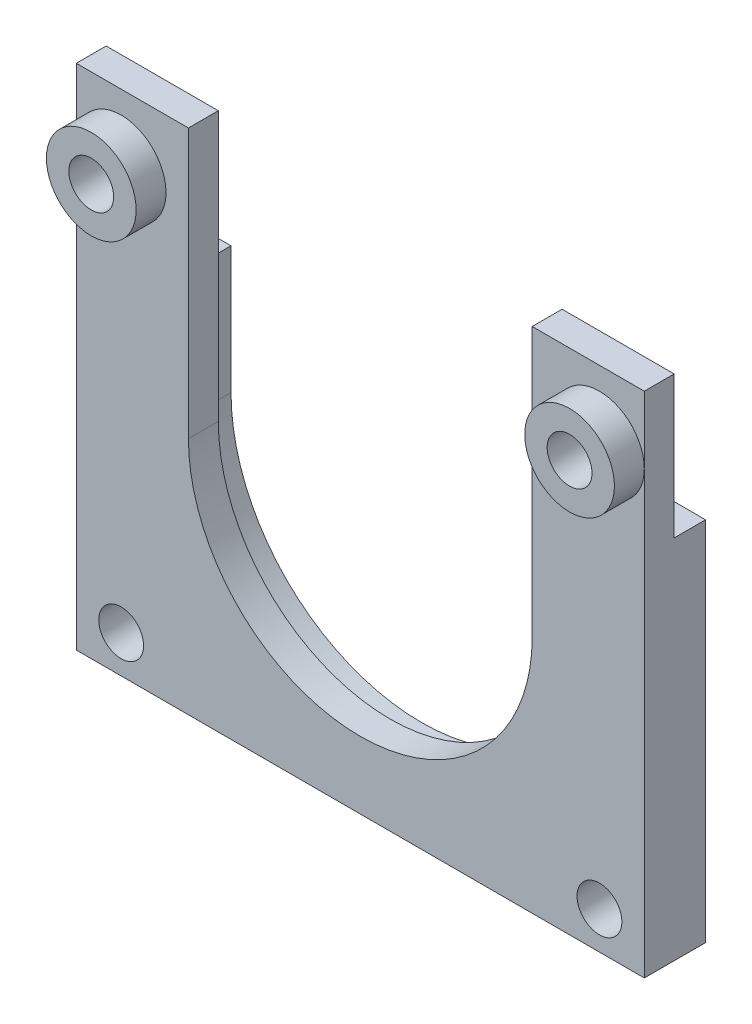
from build123d import *

# Parameters (mm, degrees)
SKETCH_1_R          = 1.5
EXTRUDE_1_DEPTH     = 4.1
EXTRUDE_START       = -2
EXTRUDE_2_DEPTH     = 2
SKETCH_3_W          = 78.409677764
SKETCH_3_H          = 10
CUT_EXTRUDE_1_DEPTH = 2.1
SKETCH_4_W          = 7.5
SKETCH_4_H          = 2
EXTRUDE_3_DEPTH     = 2
SKETCH_5_R          = 3
SKETCH_5_R_2        = 1.5
EXTRUDE_4_DEPTH     = 2


with BuildPart() as part:
    # 草图1 → 凸台-拉伸1 (new body)
    with BuildSketch(Plane.XY):
        with BuildLine():
            Line((-12.75, 0), (-12.75, 16))
            Line((-12.75, 16), (-19, 16))
            Line((-19, 16), (-19, -16))
            Line((-19, -16), (19, -16))
            Line((19, -16), (19, 16))
            Line((19, 16), (12.75, 16))
            Line((12.75, 16), (12.75, 0))
            ThreePointArc((12.75, 0), (0, -12.75), (-12.75, 0))
        make_face()
        with Locations((-16, 13.5)):
            Circle(SKETCH_1_R, mode=Mode.SUBTRACT)
        with Locations((16, 13.5)):
            Circle(SKETCH_1_R, mode=Mode.SUBTRACT)
        with Locations(Location((16, -13.5, 0), (0, 0, 180))):
            Circle(SKETCH_1_R, mode=Mode.SUBTRACT)
        with Locations(Location((-16, -13.5, 0), (0, 0, 180))):
            Circle(SKETCH_1_R, mode=Mode.SUBTRACT)
    extrude(amount=EXTRUDE_1_DEPTH)

    # 草图2 → 凸台-拉伸2 (add)
    with BuildSketch(Plane.XY.offset(4.1).offset(EXTRUDE_START)):
        with BuildLine():
            Line((-12.75, 0), (-12.75, 16))
            Line((-12.75, 16), (-11.5, 16))
            Line((-11.5, 16), (-11.5, 0))
            ThreePointArc((-11.5, 0), (0, -11.5), (11.5, 0))
            Line((11.5, 0), (11.5, 16))
            Line((11.5, 16), (12.75, 16))
            Line((12.75, 16), (12.75, 0))
            ThreePointArc((12.75, 0), (0, -12.75), (-12.75, 0))
        make_face()
    extrude(amount=EXTRUDE_2_DEPTH)

    # 草图3 → 切除-拉伸1 (cut)
    with BuildSketch(Plane(origin=(0, 0, 0), x_dir=(-1, 0, 0), z_dir=(0, 0, -1))):
        with Locations((16, 13.5)):
            Rectangle(SKETCH_3_W, SKETCH_3_H)
    extrude(amount=-CUT_EXTRUDE_1_DEPTH, mode=Mode.SUBTRACT)

    # 草图4 → 凸台-拉伸3 (add)
    with BuildSketch(Plane.XY.offset(4.1)):
        with Locations((-15.25, 17)):
            Rectangle(SKETCH_4_W, SKETCH_4_H)
        with Locations((15.25, 17)):
            Rectangle(SKETCH_4_W, SKETCH_4_H)
    extrude(amount=-EXTRUDE_3_DEPTH)

    # 草图5 → 凸台-拉伸4 (add)
    # profile 1 of 2: a face of its own
    with BuildSketch(Plane.XY.offset(4.1)):
        with Locations(Location((-16, 13.5, 0), (0, 0, 180))):
            Circle(SKETCH_5_R)
        with Locations((-16, 13.5)):
            Circle(SKETCH_5_R_2, mode=Mode.SUBTRACT)
    # profile 2 of 2: a face of its own
    with BuildSketch(Plane.XY.offset(4.1)):
        with Locations((16, 13.5)):
            Circle(SKETCH_5_R)
        with Locations((16, 13.5)):
            Circle(SKETCH_5_R_2, mode=Mode.SUBTRACT)
    extrude(amount=EXTRUDE_4_DEPTH)


solid = part.part
